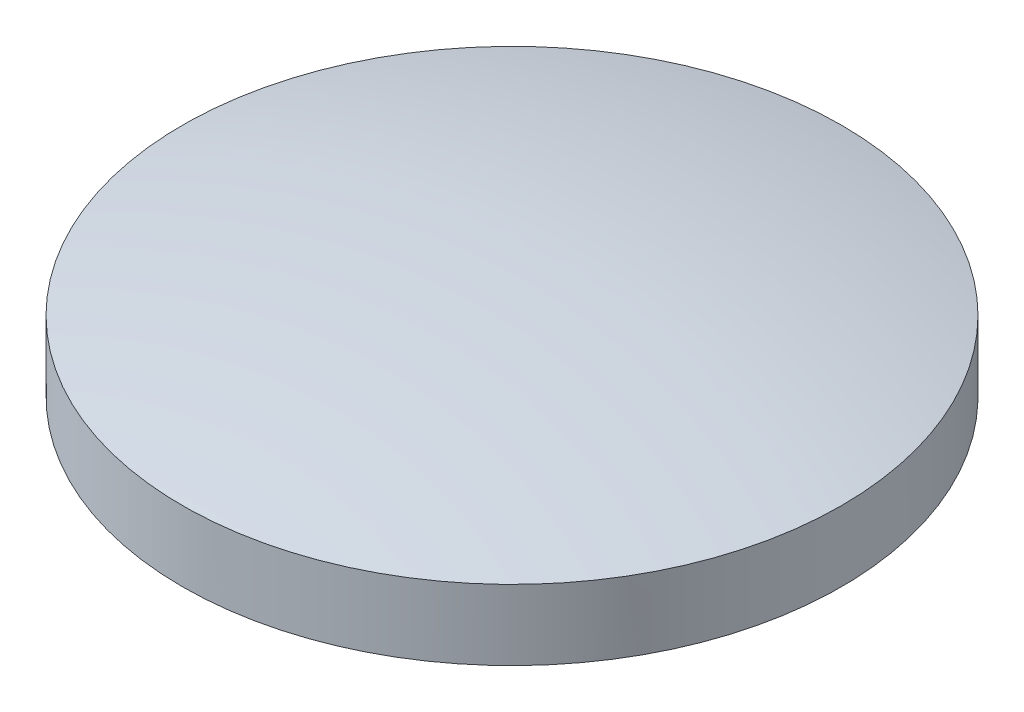
from build123d import *


with BuildPart() as part:
    # Croquis1 → Revolución1 (revolve)
    with BuildSketch(Plane.XY):
        with BuildLine():
            Line((57, 0), (59.5, 0))
            Line((59.5, 0), (59.5, 12.7))
            ThreePointArc((59.5, 12.7), (29.985744668, 18.321570419), (0, 20.205300346))
            Line((0, 20.205300346), (0, 17.705300346))
            ThreePointArc((0, 17.705300346), (28.711278697, 15.960524812), (57, 10.75187689))
            Line((57, 10.75187689), (57, 0))
        make_face()
    revolve(axis=Axis((0, 0, 0), (0, 1, 0)))


solid = part.part
